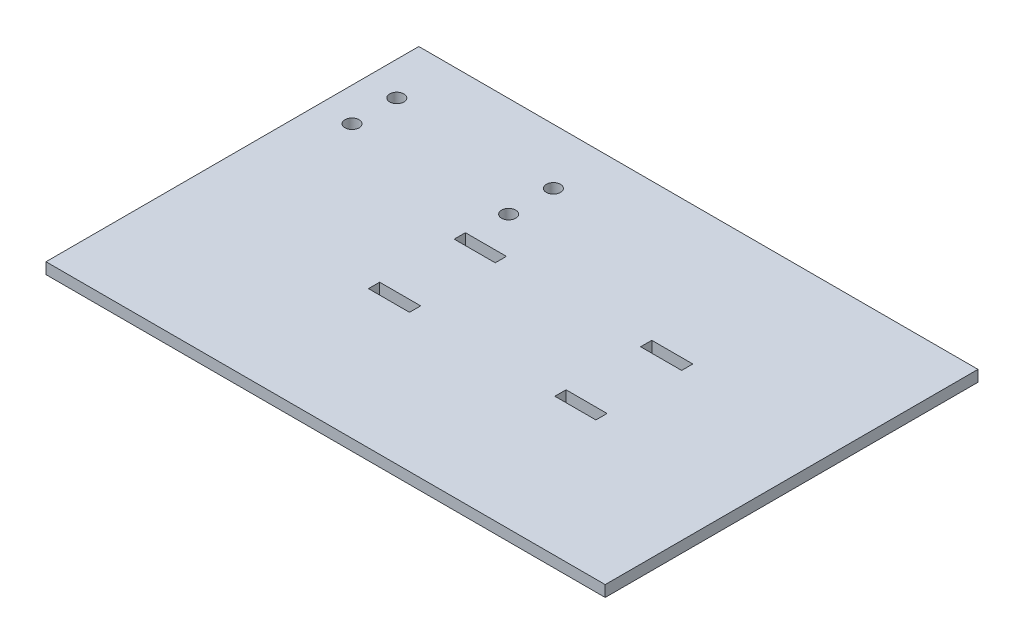
from build123d import *

# Parameters (mm, degrees)
SKETCH1_W                     = 150
SKETCH1_H                     = 100
BASEPLATE_DEPTH               = 3
F_6_CLEARANCE_HOLE1_D         = 3.7973
SKETCH4_W                     = 11
SKETCH4_H                     = 3
BASETABHOLE_DEPTH             = 131.034610777
BASETABHOLEPATTERN_COUNT      = 2
BASETABHOLEPATTERN_PITCH      = 50
BASETABHOLEPATTERN_COUNT_DIR2 = 2
BASETABHOLEPATTERN_PITCH_DIR2 = 23


with BuildPart() as part:
    # Sketch1 → BasePlate (new body)
    with BuildSketch(Plane(origin=(0, 0, 0), x_dir=(1, 0, 0), z_dir=(0, 1, 0))):
        with Locations((45, 0)):
            Rectangle(SKETCH1_W, SKETCH1_H)
    extrude(amount=-BASEPLATE_DEPTH)

    # #6 Clearance Hole1 (through all)
    with Locations(Plane(origin=(0, 0, 0), x_dir=(1, 0, 0), z_dir=(0, 1, 0))):
        with Locations((-21, 23.1), (21, 23.1), (21, 35.1), (-21, 35.1)):
            Hole(F_6_CLEARANCE_HOLE1_D / 2)

    # Sketch4 → BaseTabHole (cut, through all)
    with BuildSketch(Plane(origin=(0, 0, 0), x_dir=(1, 0, 0), z_dir=(0, 1, 0))):
        with Locations((25, 11.5)):
            Rectangle(SKETCH4_W, SKETCH4_H)
    basetabhole = extrude(amount=-BASETABHOLE_DEPTH, mode=Mode.SUBTRACT)

    # BaseTabHolePattern: BaseTabHole 2 × 2
    with Locations(*[(i * BASETABHOLEPATTERN_PITCH, 0, j * BASETABHOLEPATTERN_PITCH_DIR2) for i in range(BASETABHOLEPATTERN_COUNT) for j in range(BASETABHOLEPATTERN_COUNT_DIR2) if (i, j) != (0, 0)]):
        add(basetabhole, mode=Mode.SUBTRACT)


solid = part.part
